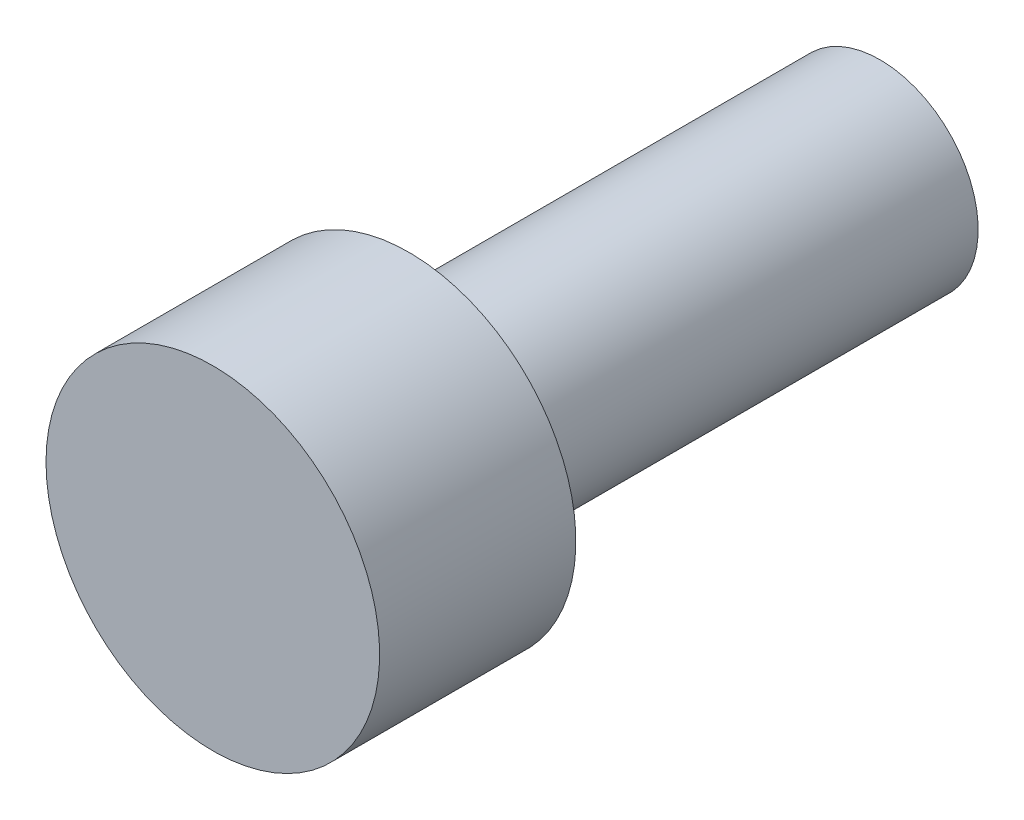
from build123d import *


with BuildPart() as part:
    # Sketch1 → REV_ISO4762_M5x12_8.8 (revolve)
    with BuildSketch(Plane(origin=(0, 0, 0), x_dir=(1, 0, 0), z_dir=(0, 1, 0)), mode=Mode.PRIVATE) as rev_iso4762_m5x12_8_8_sk:
        Polygon((0, -5), (4.25, -5), (4.25, 0), (2.5, 0), (2.5, 12), (0, 12), align=None)
    revolve(rev_iso4762_m5x12_8_8_sk.sketch.rotate(Axis((0, 0, -12), (0, 0, 1)), 180), axis=Axis((0, 0, -12), (0, 0, 1)))


solid = part.part
